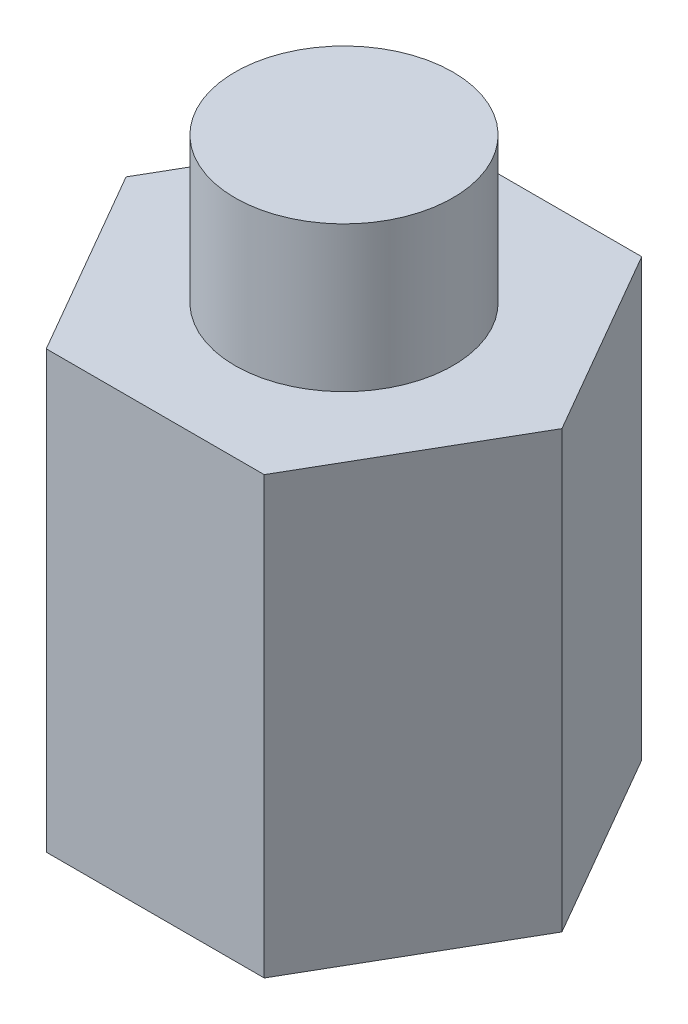
from build123d import *

# Parameters (mm, degrees)
SKETCH_1_R           = 1.5
EXTRUDE_1_DEPTH      = 6
EXTRUDE_2_DEPTH      = 2
EXTRUDE_2_DEPTH_BACK = 1
SKETCH_2_R           = 1.5


with BuildPart() as part:
    # 草图1 → 凸台-拉伸1 (new body)
    with BuildSketch(Plane(origin=(0, 0, 0), x_dir=(1, 0, 0), z_dir=(0, 1, 0))):
        Polygon((3, 0), (1.5, 2.598076211), (-1.5, 2.598076211), (-3, 0), (-1.5, -2.598076211), (1.5, -2.598076211), align=None)
        with Locations(Location((0, 0, 0), (0, 0, 270))):
            Circle(SKETCH_1_R, mode=Mode.SUBTRACT)
    extrude(amount=EXTRUDE_1_DEPTH)

    # 草图2 → 凸台-拉伸2 (add, two sides: drawn at the far end of the back side and taken through both)
    with BuildSketch(Plane(origin=(0, 6, 0), x_dir=(1, 0, 0), z_dir=(0, 1, 0)).offset(-EXTRUDE_2_DEPTH_BACK)):
        with Locations(Location((0, 0, 0), (0, 0, 270))):
            Circle(SKETCH_2_R)
    extrude(amount=EXTRUDE_2_DEPTH + EXTRUDE_2_DEPTH_BACK)


solid = part.part
